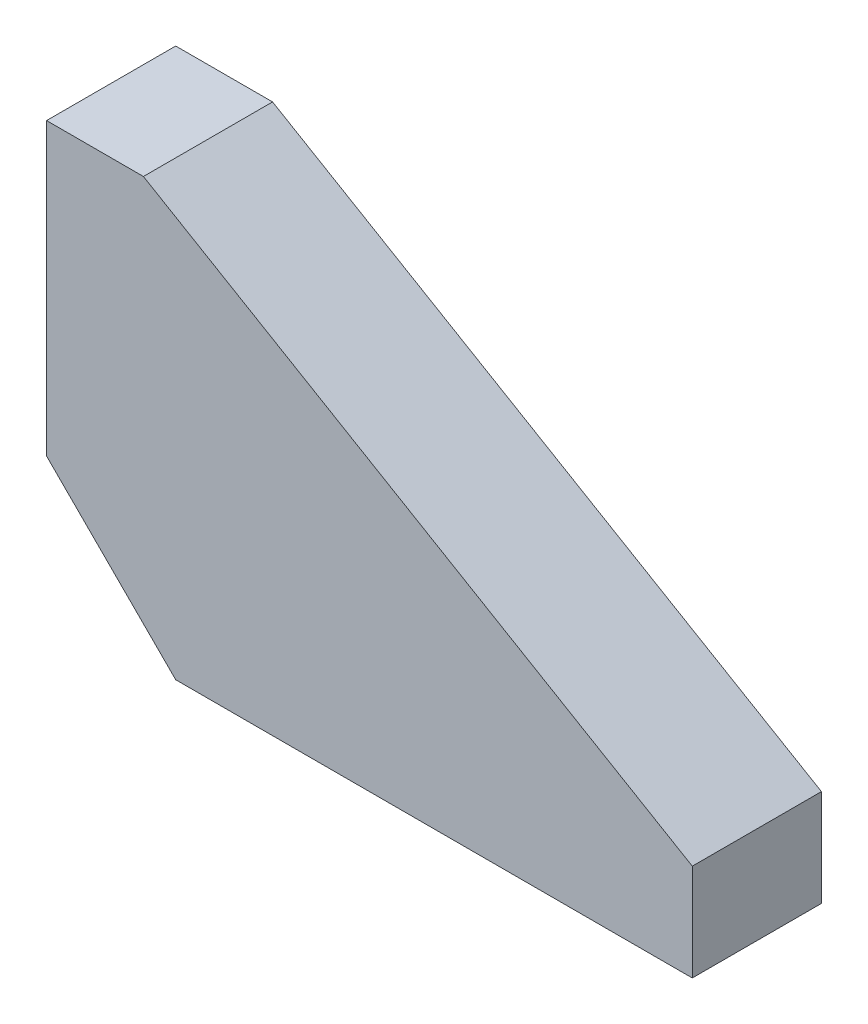
from build123d import *

# Parameters (mm, degrees)
EXTRUDE_1_DEPTH = 20


with BuildPart() as part:
    # 草图1 → 凸台-拉伸1 (new body)
    with BuildSketch(Plane.XY):
        Polygon((0, 0), (15, 0), (100, -50), (100, -65), (20, -65), (0, -45), align=None)
    extrude(amount=EXTRUDE_1_DEPTH)


solid = part.part
